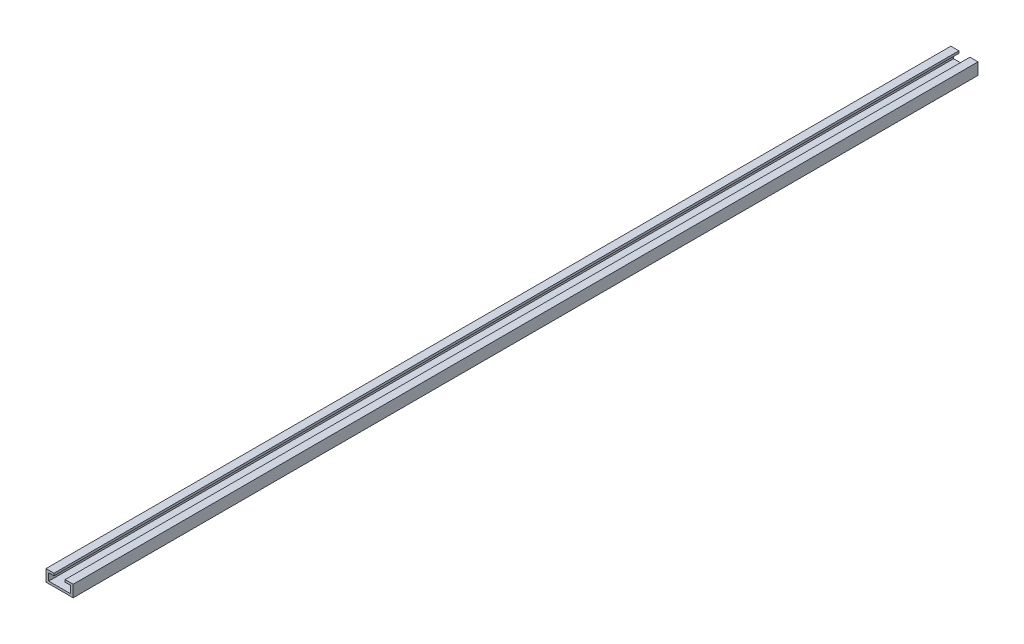
from build123d import *

# Parameters (mm, degrees)
BOSS_EXTRUDE1_DEPTH = 1000


with BuildPart() as part:
    # Sketch1 → Boss-Extrude1 (new body)
    with BuildSketch(Plane.XY):
        Polygon((-15, 0), (15, 0), (15, 13.028297731), (12, 13.028297731), (6.1, 13.028297731), (6.1, 10.528297731), (12, 10.528297731), (12, 2.5), (-12, 2.5), (-12, 10.528297731), (-6.1, 10.528297731), (-6.1, 13.028297731), (-12, 13.028297731), (-15, 13.028297731), align=None)
    extrude(amount=BOSS_EXTRUDE1_DEPTH)


solid = part.part
